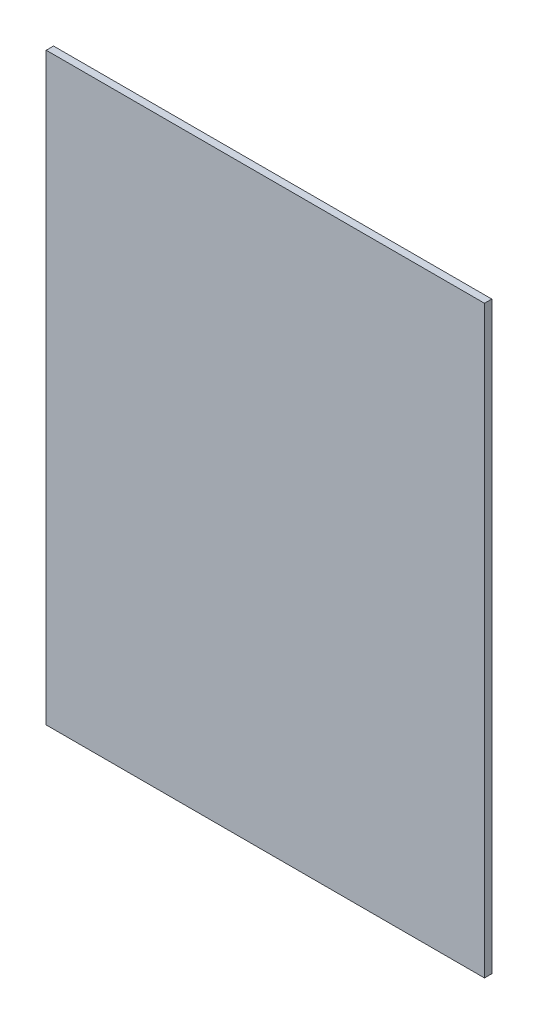
from build123d import *

# Parameters (mm, degrees)
ESQUISSE1_W        = 600
ESQUISSE1_H        = 800
BOSS_EXTRU_1_DEPTH = 10


with BuildPart() as part:
    # Esquisse1 → Boss.-Extru.1 (new body)
    with BuildSketch(Plane.XY):
        with Locations((50, 0)):
            Rectangle(ESQUISSE1_W, ESQUISSE1_H)
    extrude(amount=BOSS_EXTRU_1_DEPTH)


solid = part.part
